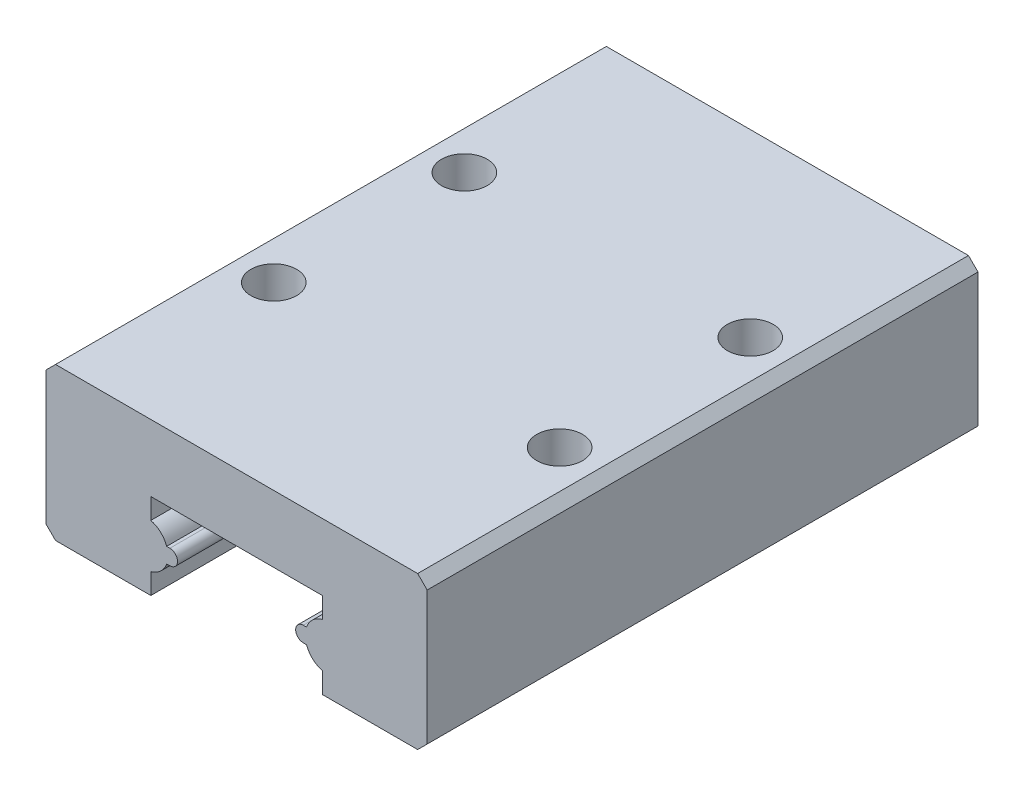
from build123d import *

# Parameters (mm, degrees)
EXTRUDE_1_DEPTH     = 28.9
SKETCH_2_R          = 1.2
CUT_EXTRUDE_1_DEPTH = 5


with BuildPart() as part:
    # 草图1 → 凸台-拉伸1 (new body)
    with BuildSketch(Plane.XY):
        with BuildLine():
            Line((0, 0.5), (0, 7.5))
            Line((0, 7.5), (0.5, 8))
            Line((0.5, 8), (19.5, 8))
            Line((19.5, 8), (20, 7.5))
            Line((20, 7.5), (20, 0.5))
            Line((20, 0.5), (19.5, 0))
            Line((19.5, 0), (14.5, 0))
            Line((14.5, 0), (14.5, 1.088104996))
            ThreePointArc((14.5, 1.088104996), (13.989243177, 1.365311708), (13.66862915, 1.85))
            Line((13.66862915, 1.85), (13.5, 1.85))
            ThreePointArc((13.5, 1.85), (13.1, 2.25), (13.5, 2.65))
            Line((13.5, 2.65), (13.66862915, 2.65))
            ThreePointArc((13.66862915, 2.65), (13.989243177, 3.134688292), (14.5, 3.411895004))
            Line((14.5, 3.411895004), (14.5, 4.5))
            Line((14.5, 4.5), (5.5, 4.5))
            Line((5.5, 4.5), (5.5, 3.411895004))
            ThreePointArc((5.5, 3.411895004), (6.010756823, 3.134688292), (6.33137085, 2.65))
            Line((6.33137085, 2.65), (6.5, 2.65))
            ThreePointArc((6.5, 2.65), (6.9, 2.25), (6.5, 1.85))
            Line((6.5, 1.85), (6.33137085, 1.85))
            ThreePointArc((6.33137085, 1.85), (6.010756823, 1.365311708), (5.5, 1.088104996))
            Line((5.5, 1.088104996), (5.5, 0))
            Line((5.5, 0), (0.5, 0))
            Line((0.5, 0), (0, 0.5))
        make_face()
    extrude(amount=EXTRUDE_1_DEPTH)

    # 草图2 → 切除-拉伸1 (cut)
    with BuildSketch(Plane(origin=(0, 8, 0), x_dir=(1, 0, 0), z_dir=(0, 1, 0))):
        with Locations(Location((2.5, -19.45, 0), (0, 0, 270))):
            Circle(SKETCH_2_R)
        with Locations(Location((2.5, -9.45, 0), (0, 0, 270))):
            Circle(SKETCH_2_R)
        with Locations(Location((17.5, -9.45, 0), (0, 0, 270))):
            Circle(SKETCH_2_R)
        with Locations(Location((17.5, -19.45, 0), (0, 0, 270))):
            Circle(SKETCH_2_R)
    extrude(amount=-CUT_EXTRUDE_1_DEPTH, mode=Mode.SUBTRACT)


solid = part.part
